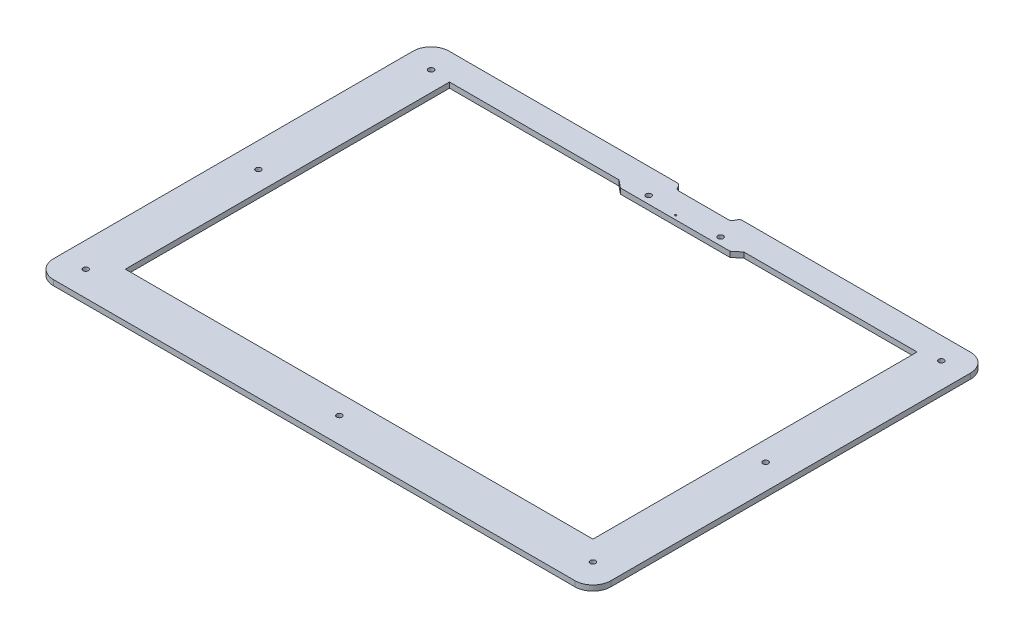
from build123d import *

# Parameters (mm, degrees)
SKETCH_1_R      = 1.5
SKETCH_1_R_2    = 0.5
EXTRUDE_1_DEPTH = 3


with BuildPart() as part:
    # 草图1 → 凸台-拉伸1 (new body)
    with BuildSketch(Plane(origin=(0, 0, 0), x_dir=(1, 0, 0), z_dir=(0, 1, 0))):
        with BuildLine():
            Line((10, 0), (136.884360712, 0))
            ThreePointArc((136.884360712, 0), (137.900113715, -0.277140216), (138.634360712, -1.031754163))
            Line((138.634360712, -1.031754163), (139.429147615, -2.468245837))
            ThreePointArc((139.429147615, -2.468245837), (140.163394612, -3.222859784), (141.179147615, -3.5))
            Line((141.179147615, -3.5), (168.820852385, -3.5))
            ThreePointArc((168.820852385, -3.5), (169.836605388, -3.222859784), (170.570852385, -2.468245837))
            Line((170.570852385, -2.468245837), (171.365639288, -1.031754163))
            ThreePointArc((171.365639288, -1.031754163), (172.099886285, -0.277140216), (173.115639288, 0))
            Line((173.115639288, 0), (300, 0))
            ThreePointArc((300, 0), (307.071067812, -2.928932188), (310, -10))
            Line((310, -10), (310, -210))
            ThreePointArc((310, -210), (307.071067812, -217.071067812), (300, -220))
            Line((300, -220), (10, -220))
            ThreePointArc((10, -220), (2.928932188, -217.071067812), (0, -210))
            Line((0, -210), (0, -10))
            ThreePointArc((0, -10), (2.928932188, -2.928932188), (10, 0))
        make_face()
        with Locations(Location((14, -14, 0), (0, 0, 270))):
            Circle(SKETCH_1_R, mode=Mode.SUBTRACT)
        with Locations(Location((14, -206, 0), (0, 0, 270))):
            Circle(SKETCH_1_R, mode=Mode.SUBTRACT)
        with Locations(Location((296, -206, 0), (0, 0, 270))):
            Circle(SKETCH_1_R, mode=Mode.SUBTRACT)
        with Locations(Location((296, -12.28568254, 0), (0, 0, 270))):
            Circle(SKETCH_1_R, mode=Mode.SUBTRACT)
        with Locations(Location((155, -206, 0), (0, 0, 270))):
            Circle(SKETCH_1_R, mode=Mode.SUBTRACT)
        with Locations(Location((175, -14, 0), (0, 0, 270))):
            Circle(SKETCH_1_R, mode=Mode.SUBTRACT)
        with Locations(Location((135, -14, 0), (0, 0, 270))):
            Circle(SKETCH_1_R, mode=Mode.SUBTRACT)
        with Locations(Location((296, -110, 0), (0, 0, 270))):
            Circle(SKETCH_1_R, mode=Mode.SUBTRACT)
        with Locations(Location((14, -110, 0), (0, 0, 270))):
            Circle(SKETCH_1_R, mode=Mode.SUBTRACT)
        with Locations(Location((152, -16, 0), (0, 0, 270))):
            Circle(SKETCH_1_R_2, mode=Mode.SUBTRACT)
        Polygon((184.455213096, -18.25), (188.75, -14.75), (285, -14.75), (285, -195), (25, -195), (25, -14.75), (119.25, -14.75), (123.544786904, -18.25), (141.179147615, -18.25), (168.820852385, -18.25), align=None, mode=Mode.SUBTRACT)
    extrude(amount=EXTRUDE_1_DEPTH)


solid = part.part
